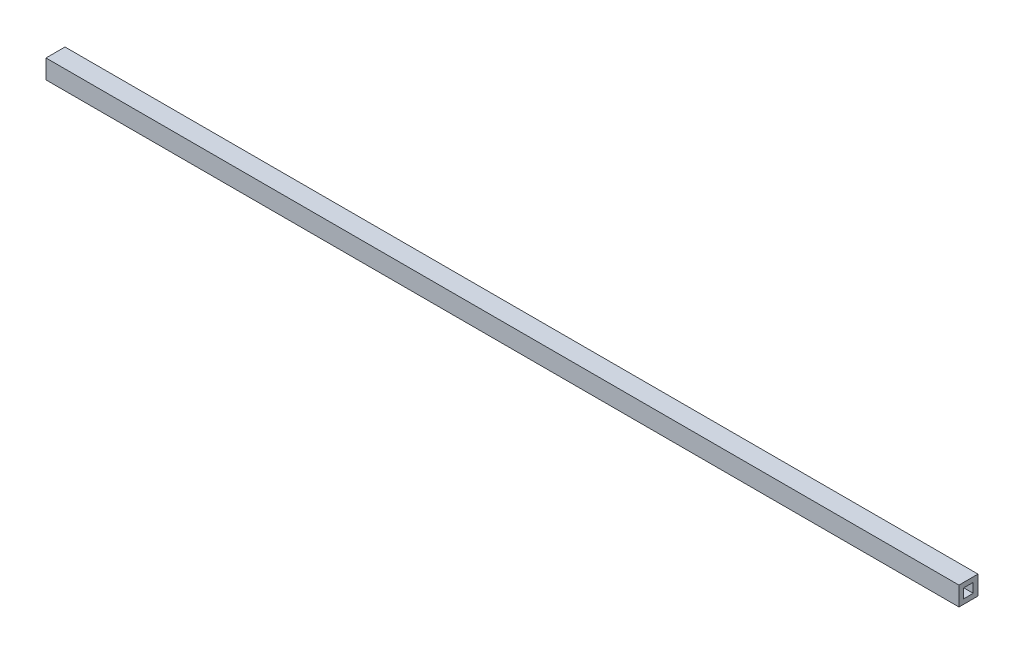
from build123d import *

# Parameters (mm, degrees)
SKETCH1_W           = 1219.2
SKETCH1_H           = 25.4
BOSS_EXTRUDE1_DEPTH = 25.4
SKETCH2_W           = 12.7
SKETCH2_H           = 12.7
CUT_EXTRUDE1_DEPTH  = 1220.530684321


with BuildPart() as part:
    # Sketch1 → Boss-Extrude1 (new body)
    with BuildSketch(Plane.XY):
        Rectangle(SKETCH1_W, SKETCH1_H)
    extrude(amount=BOSS_EXTRUDE1_DEPTH)

    # Sketch2 → Cut-Extrude1 (cut, through all)
    with BuildSketch(Plane(origin=(609.6, 0, 0), x_dir=(0, 0, -1), z_dir=(1, 0, 0))):
        with Locations((-12.7, 0)):
            Rectangle(SKETCH2_W, SKETCH2_H)
    extrude(amount=-CUT_EXTRUDE1_DEPTH, mode=Mode.SUBTRACT)


solid = part.part
